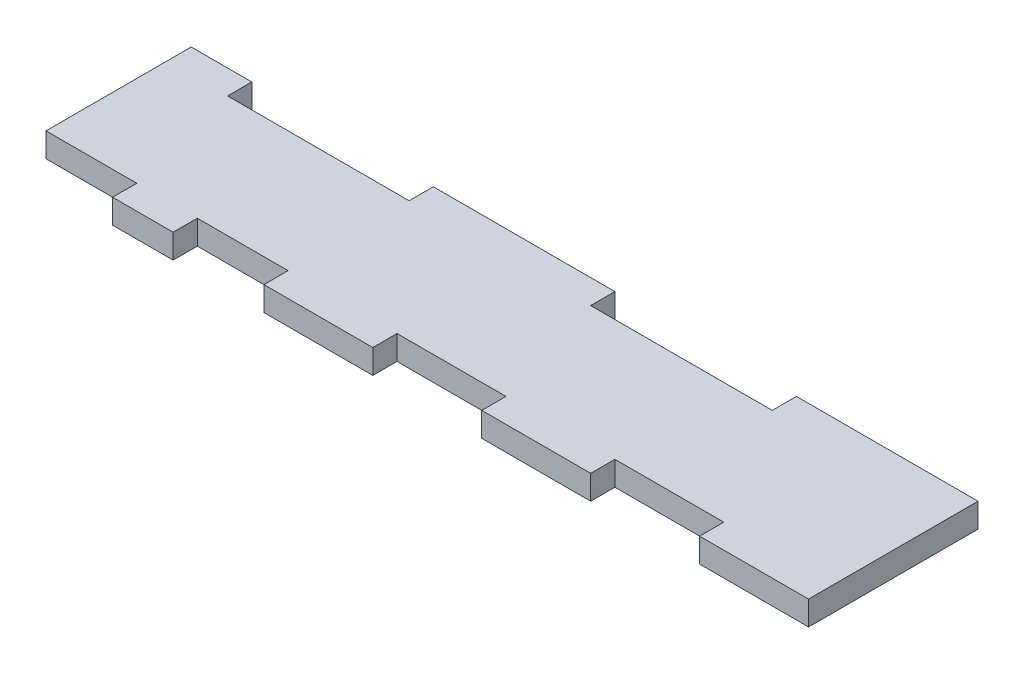
from build123d import *

# Parameters (mm, degrees)
BOSS_EXTRUDE1_DEPTH = 2


with BuildPart() as part:
    # Sketch1 → Boss-Extrude1 (new, symmetric)
    with BuildSketch(Plane(origin=(0, 0, 0), x_dir=(1, 0, 0), z_dir=(0, 1, 0))):
        Polygon((-65, -10), (-50, -10), (-50, -14), (-40, -14), (-40, -10), (-25, -10), (-25, -14), (-7, -14), (-7, -10), (11, -10), (11, -14), (29, -14), (29, -10), (47, -10), (47, -14), (65, -14), (65, -10), (65, 10), (65, 14), (35, 14), (35, 10), (5, 10), (5, 14), (-25, 14), (-25, 10), (-55, 10), (-55, 14), (-65, 14), (-65, 10), align=None)
    extrude(amount=BOSS_EXTRUDE1_DEPTH, both=True)


solid = part.part
